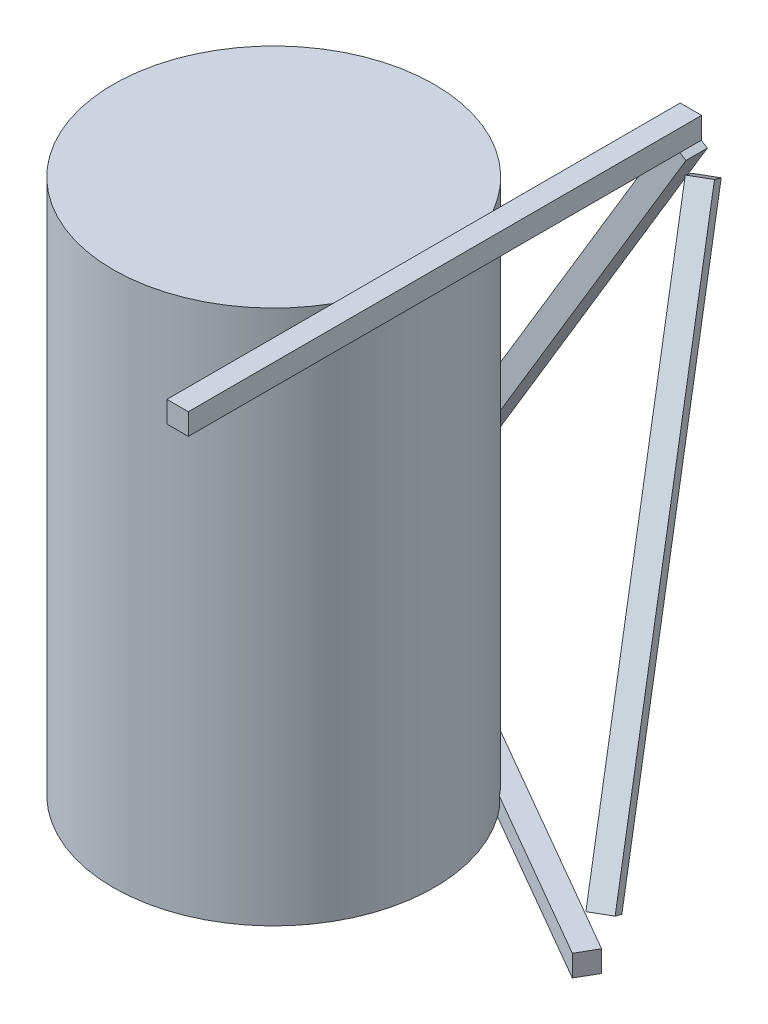
from build123d import *

# Parameters (mm, degrees)
CROQUIS4_R              = 150
SALIENTE_EXTRUIR1_DEPTH = 500
CROQUIS5_W              = 20
CROQUIS5_H              = 20
SALIENTE_EXTRUIR2_DEPTH = 246.547594742
CROQUIS6_W              = 20
CROQUIS6_H              = 20
SALIENTE_EXTRUIR3_DEPTH = 239.807621135
SALIENTE_EXTRUIR4_DEPTH = 246.547594742
CROQUIS8_W              = 20
CROQUIS8_H              = 20
SALIENTE_EXTRUIR5_DEPTH = 239.807621135


with BuildPart() as part:
    # Croquis4 → Saliente-Extruir1 (new body)
    with BuildSketch(Plane(origin=(0, 0, 0), x_dir=(1, 0, 0), z_dir=(0, 1, 0))):
        with Locations(Location((0, 0, 0), (0, 0, 270))):
            Circle(CROQUIS4_R)
    extrude(amount=SALIENTE_EXTRUIR1_DEPTH)


with BuildPart() as body_2:
    # Croquis5 → Saliente-Extruir2 (new, symmetric)
    with BuildSketch(Plane(origin=(110.294117647, 183.823529412, 0), x_dir=(-0.8574929257125442, 0.5144957554275267, 0), z_dir=(-0.5144957554275266, -0.8574929257125441, 0))):
        with Locations((128.623938857, 259.807621135)):
            Rectangle(CROQUIS5_W, CROQUIS5_H)
    extrude(amount=SALIENTE_EXTRUIR2_DEPTH, both=True)


with BuildPart() as body_3:
    # Croquis6 → Saliente-Extruir3 (new, symmetric)
    with BuildSketch(Plane(origin=(0, 0, 0), x_dir=(-1, 0, 0), z_dir=(0, 0, -1))):
        with Locations((-150, 500)):
            Rectangle(CROQUIS6_W, CROQUIS6_H)
    extrude(amount=SALIENTE_EXTRUIR3_DEPTH, both=True)


with BuildPart() as body_4:
    # Croquis7 → Saliente-Extruir4 (new, symmetric)
    with BuildSketch(Plane(origin=(-55.147058824, 183.823529412, -95.51750777), x_dir=(-0.9658390305087126, -0.24307639633206138, 0.08982668140485241), z_dir=(0.257247877713763, -0.8574929257125443, 0.4455663943395036))):
        Polygon((-303.289809836, 5.295290027), (-285.662720294, -4.153821798), (-276.213608469, 13.473267744), (-293.840698011, 22.922379569), align=None)
    extrude(amount=SALIENTE_EXTRUIR4_DEPTH, both=True)


with BuildPart() as body_5:
    # Croquis8 → Saliente-Extruir5 (new, symmetric)
    with BuildSketch(Plane(origin=(0, 0, 0), x_dir=(-0.5000000000000003, 0, 0.8660254037844386), z_dir=(-0.8660254037844385, 0, -0.5000000000000002))):
        with Locations((-150, 0)):
            Rectangle(CROQUIS8_W, CROQUIS8_H)
    extrude(amount=SALIENTE_EXTRUIR5_DEPTH, both=True)


solid = Compound([part.part, body_2.part, body_3.part, body_4.part, body_5.part])
